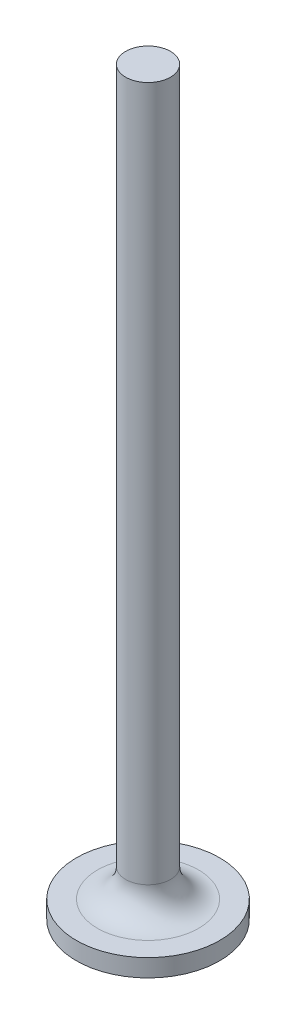
from build123d import *

# Parameters (mm, degrees)
FILLET1_R = 4


with BuildPart() as part:
    # Sketch1 → Revolve1 (revolve)
    with BuildSketch(Plane.XY, mode=Mode.PRIVATE) as revolve1_sk:
        Polygon((0, 0), (10.16, 0), (10.16, 2.5), (3.175, 2.5), (3.175, 105), (0, 105), align=None)
    revolve(revolve1_sk.sketch.rotate(Axis((0, -31.831703756, 0), (0, 1, 0)), 90), axis=Axis((0, -31.831703756, 0), (0, 1, 0)))

    # Fillet1
    fillet1_edges = [part.edges().sort_by_distance(p)[0] for p in [
        (0, 2.5, 3.175),
    ]]
    fillet(fillet1_edges, radius=FILLET1_R)


solid = part.part
